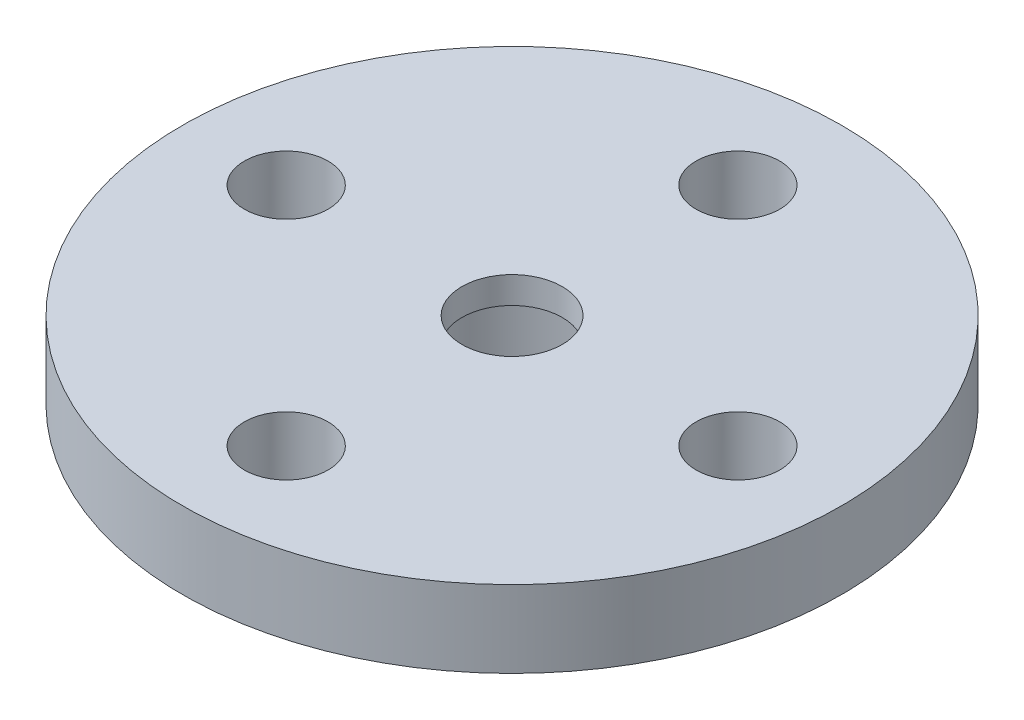
from build123d import *

# Parameters (mm, degrees)
HOLE_WIZARD_M3_1_D = 2.5


with BuildPart() as part:
    # 草图1 → 旋转1 (revolve)
    with BuildSketch(Plane.XY, mode=Mode.PRIVATE) as revolve_1_sk:
        Polygon((1.5, 0), (9.85, 0), (9.85, -2.3), (4.4, -2.3), (4.4, -4.3), (3, -4.3), (3, -0.8), (1.5, -0.8), align=None)
    revolve(revolve_1_sk.sketch.rotate(Axis((0, 0, 0), (0, 1, 0)), 90), axis=Axis((0, 0, 0), (0, 1, 0)))

    # M3 螺纹孔1 (through all)
    with Locations(Plane(origin=(0, 0, 0), x_dir=(1, 0, 0), z_dir=(0, 1, 0))):
        with Locations((0, 6.75), (6.75, 0), (0, -6.75), (-6.75, 0)):
            Hole(HOLE_WIZARD_M3_1_D / 2)


solid = part.part
